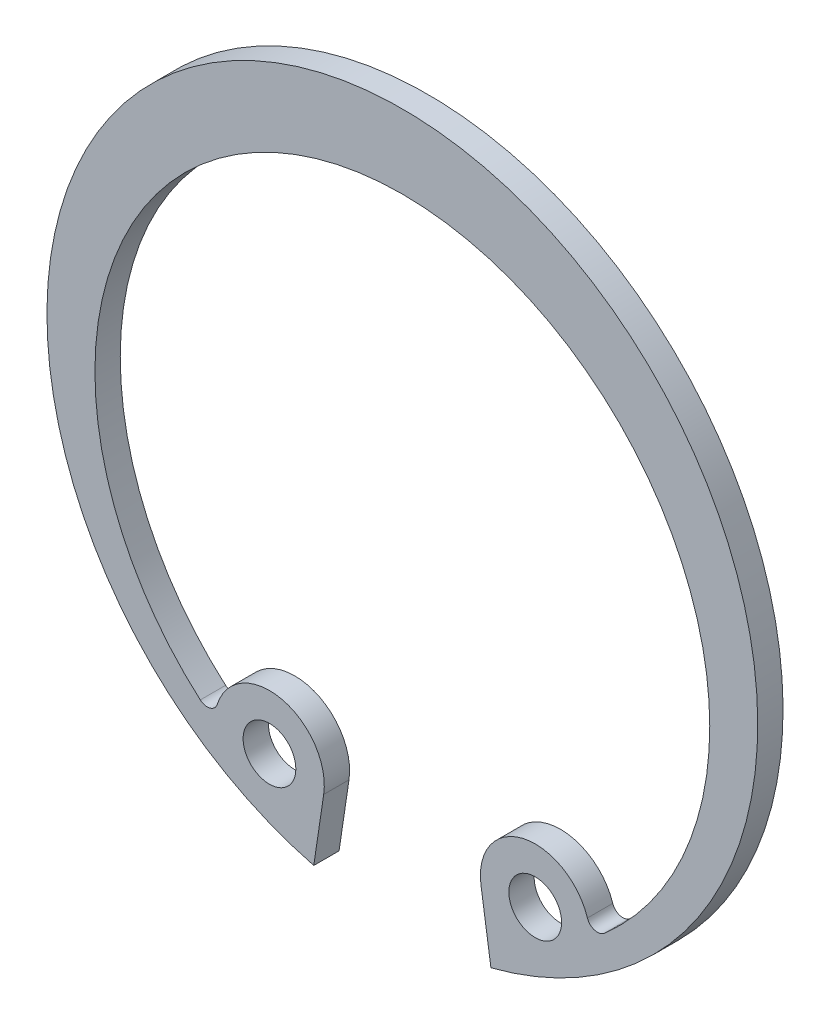
from build123d import *

# Parameters (mm, degrees)
SKETCH1_R           = 1.25
BOSS_EXTRUDE1_DEPTH = 1.2


with BuildPart() as part:
    # Sketch1 → Boss-Extrude1 (new body)
    with BuildSketch(Plane.XY):
        with BuildLine():
            Line((-3.728853942, -13.165652838), (-4.2, -16.318164725))
            ThreePointArc((-4.2, -16.318164725), (0, 16.85), (4.2, -16.318164725))
            Line((4.2, -16.318164725), (3.728853942, -13.165652838))
            ThreePointArc((3.728853942, -13.165652838), (5.708115152, -10.24996593), (8.774969741, -11.985796572))
            ThreePointArc((8.774969741, -11.985796572), (9.116990276, -12.314492079), (9.579611723, -12.209610336))
            ThreePointArc((9.579611723, -12.209610336), (0, 13.35), (-9.579611723, -12.209610336))
            ThreePointArc((-9.579611723, -12.209610336), (-9.116990276, -12.314492079), (-8.774969741, -11.985796572))
            ThreePointArc((-8.774969741, -11.985796572), (-5.708115152, -10.24996593), (-3.728853942, -13.165652838))
        make_face()
        with Locations((-6.3, -12.781392485)):
            Circle(SKETCH1_R, mode=Mode.SUBTRACT)
        with Locations((6.3, -12.781392485)):
            Circle(SKETCH1_R, mode=Mode.SUBTRACT)
    extrude(amount=BOSS_EXTRUDE1_DEPTH)


solid = part.part
